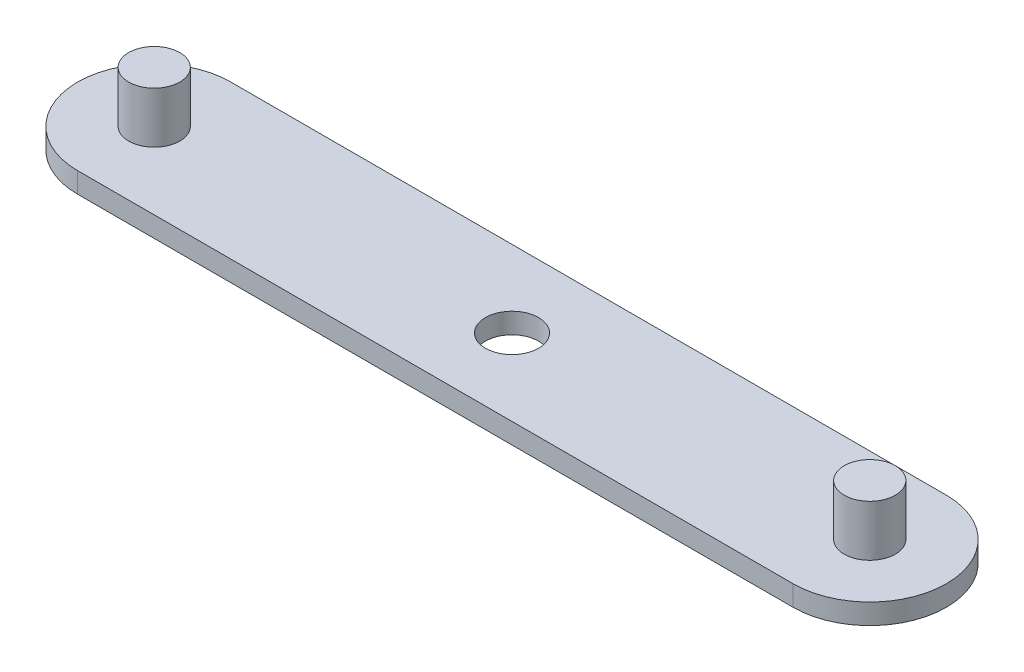
from build123d import *

# Parameters (mm, degrees)
SKETCH1_W           = 88.9
SKETCH1_H           = 19.05
BOSS_EXTRUDE1_DEPTH = 2.54
SKETCH2_R           = 3.175
BOSS_EXTRUDE2_DEPTH = 6.35
CUT_EXTRUDE1_REACH  = 57.176
SKETCH3_R           = 3.302


with BuildPart() as part:
    # Sketch1 → Boss-Extrude1 (new body)
    with BuildSketch(Plane(origin=(0, 0, 0), x_dir=(1, 0, 0), z_dir=(0, 1, 0))):
        with BuildLine():
            ThreePointArc((-44.45, -9.525), (-53.975, 0), (-44.45, 9.525))
            Line((-44.45, 9.525), (-44.45, -9.525))
        make_face()
        Rectangle(SKETCH1_W, SKETCH1_H)
        with BuildLine():
            ThreePointArc((44.45, 9.525), (53.975, 0), (44.45, -9.525))
            Line((44.45, -9.525), (44.45, 9.525))
        make_face()
    extrude(amount=BOSS_EXTRUDE1_DEPTH)

    # Sketch2 → Boss-Extrude2 (add)
    with BuildSketch(Plane(origin=(0, 2.54, 0), x_dir=(1, 0, 0), z_dir=(0, 1, 0))):
        with Locations(Location((-44.45, 0, 0), (0, 0, 270))):
            Circle(SKETCH2_R)
        with Locations(Location((44.45, 0, 0), (0, 0, 270))):
            Circle(SKETCH2_R)
    extrude(amount=BOSS_EXTRUDE2_DEPTH)

    # Sketch3 → Cut-Extrude1 (cut, up to next)
    with BuildSketch(Plane(origin=(0, 2.54, 0), x_dir=(1, 0, 0), z_dir=(0, 1, 0)), mode=Mode.PRIVATE) as cut_extrude1_sk1:
        with Locations(Location((0, 0, 0), (0, 0, 270))):
            Circle(SKETCH3_R)
    cut_extrude1_tool1 = extrude(cut_extrude1_sk1.sketch, amount=-CUT_EXTRUDE1_REACH, mode=Mode.PRIVATE) & part.part
    add(cut_extrude1_tool1.solids().sort_by_distance((0, 2.54, 0))[0], mode=Mode.SUBTRACT)


solid = part.part
